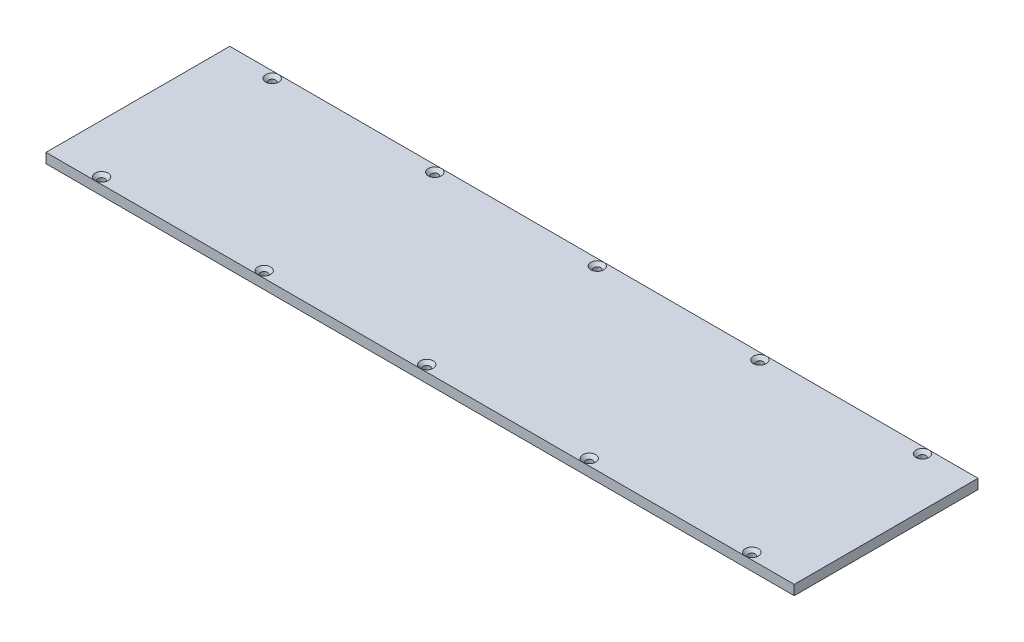
from build123d import *

# Parameters (mm, degrees)
SKETCH1_W                                       = 723.9
SKETCH1_H                                       = 177.8
BOSS_EXTRUDE1_DEPTH                             = 9.525
CSK_FOR_M6_FLAT_HEAD_MACHINE_SCREW1_D           = 6.6
CSK_FOR_M6_FLAT_HEAD_MACHINE_SCREW1_CSINK_D     = 12.6
CSK_FOR_M6_FLAT_HEAD_MACHINE_SCREW1_CSINK_ANGLE = 90


with BuildPart() as part:
    # Sketch1 → Boss-Extrude1 (new body)
    with BuildSketch(Plane(origin=(0, 0, 0), x_dir=(1, 0, 0), z_dir=(0, 1, 0))):
        Rectangle(SKETCH1_W, SKETCH1_H)
    extrude(amount=BOSS_EXTRUDE1_DEPTH)

    # CSK for M6 Flat Head Machine Screw1 (through all)
    with Locations(Plane(origin=(0, 9.525, 0), x_dir=(1, 0, 0), z_dir=(0, 1, 0))):
        with Locations((314.5436, 82.55), (-157.2718, 82.55), (157.2718, 82.55), (-157.2718, -82.55), (157.2718, -82.55), (314.5436, -82.55), (-314.5436, 82.55), (-314.5436, -82.55), (0, -82.55), (0, 82.55)):
            CounterSinkHole(CSK_FOR_M6_FLAT_HEAD_MACHINE_SCREW1_D / 2, CSK_FOR_M6_FLAT_HEAD_MACHINE_SCREW1_CSINK_D / 2, counter_sink_angle=CSK_FOR_M6_FLAT_HEAD_MACHINE_SCREW1_CSINK_ANGLE)


solid = part.part
